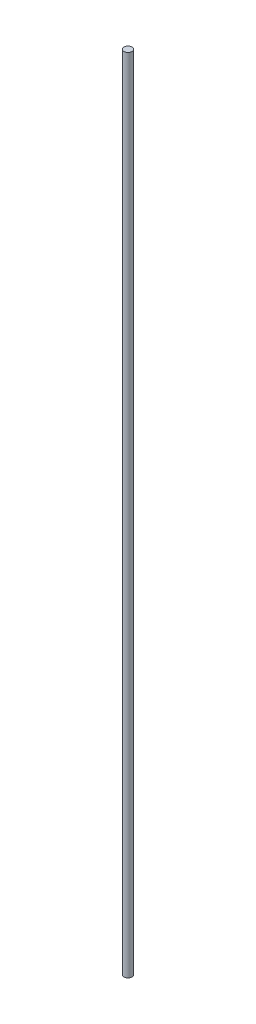
from build123d import *

# Parameters (mm, degrees)
BOSS_EXTRUDE1_DEPTH      = 410
BOSS_EXTRUDE1_DEPTH_BACK = 400
SKETCH1_R                = 4


with BuildPart() as part:
    # Sketch1 → Boss-Extrude1 (new, two sides: drawn at the far end of the back side and taken through both)
    with BuildSketch(Plane(origin=(0, 0, 0), x_dir=(1, 0, 0), z_dir=(0, 1, 0)).offset(-BOSS_EXTRUDE1_DEPTH_BACK)):
        with Locations(Location((0, 0, 0), (0, 0, 270))):
            Circle(SKETCH1_R)
    extrude(amount=BOSS_EXTRUDE1_DEPTH + BOSS_EXTRUDE1_DEPTH_BACK)


solid = part.part
